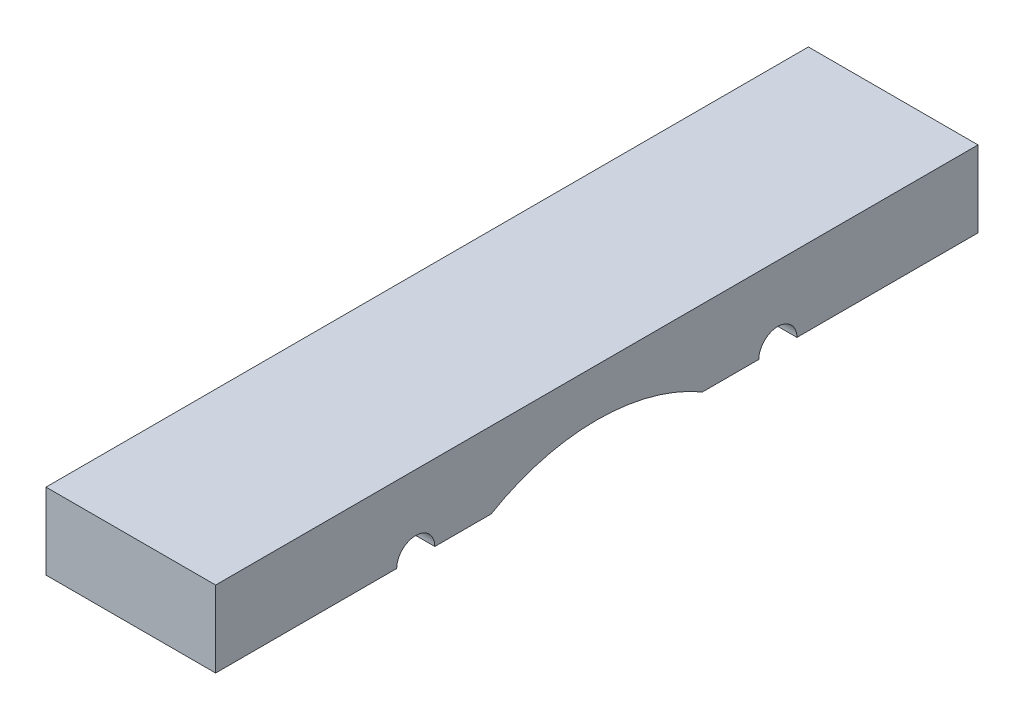
from build123d import *

# Parameters (mm, degrees)
SKETCH1_W           = 8.9
SKETCH1_H           = 40
BOSS_EXTRUDE1_DEPTH = 29.39
SKETCH5_W           = 27.9
SKETCH5_H           = 23.3
CUT_EXTRUDE2_DEPTH  = 37.646720181
SKETCH7_R           = 1
SKETCH7_R_2         = 11
CUT_EXTRUDE3_DEPTH  = 37.646720181
SKETCH8_W           = 40
SKETCH8_H           = 23.3
CUT_EXTRUDE4_DEPTH  = 37.646720181
SKETCH9_W           = 40
SKETCH9_H           = 2.09
CUT_EXTRUDE5_DEPTH  = 37.646720181


with BuildPart() as part:
    # Sketch1 → Boss-Extrude1 (new body)
    with BuildSketch(Plane(origin=(0, 0, 0), x_dir=(1, 0, 0), z_dir=(0, 1, 0))):
        Rectangle(SKETCH1_W, SKETCH1_H)
    extrude(amount=BOSS_EXTRUDE1_DEPTH)

    # Sketch5 → Cut-Extrude2 (cut, through all)
    with BuildSketch(Plane.ZY.offset(4.45)):
        with Locations((0, 11.65)):
            Rectangle(SKETCH5_W, SKETCH5_H)
    extrude(amount=-CUT_EXTRUDE2_DEPTH, mode=Mode.SUBTRACT)

    # Sketch7 → Cut-Extrude3 (cut, through all)
    with BuildSketch(Plane(origin=(4.45, 0, 0), x_dir=(0, 0, -1), z_dir=(1, 0, 0))):
        with Locations((9.5, 23.3)):
            Circle(SKETCH7_R)
        with Locations((-9.5, 23.3)):
            Circle(SKETCH7_R)
        with Locations((0, 13.8)):
            Circle(SKETCH7_R_2)
    extrude(amount=-CUT_EXTRUDE3_DEPTH, mode=Mode.SUBTRACT)

    # Sketch8 → Cut-Extrude4 (cut, through all)
    with BuildSketch(Plane(origin=(4.45, 0, 0), x_dir=(0, 0, -1), z_dir=(1, 0, 0))):
        with Locations((0, 11.65)):
            Rectangle(SKETCH8_W, SKETCH8_H)
    extrude(amount=-CUT_EXTRUDE4_DEPTH, mode=Mode.SUBTRACT)

    # Sketch9 → Cut-Extrude5 (cut, through all)
    with BuildSketch(Plane(origin=(4.45, 0, 0), x_dir=(0, 0, -1), z_dir=(1, 0, 0))):
        with Locations((0, 28.345)):
            Rectangle(SKETCH9_W, SKETCH9_H)
    extrude(amount=-CUT_EXTRUDE5_DEPTH, mode=Mode.SUBTRACT)


solid = part.part
